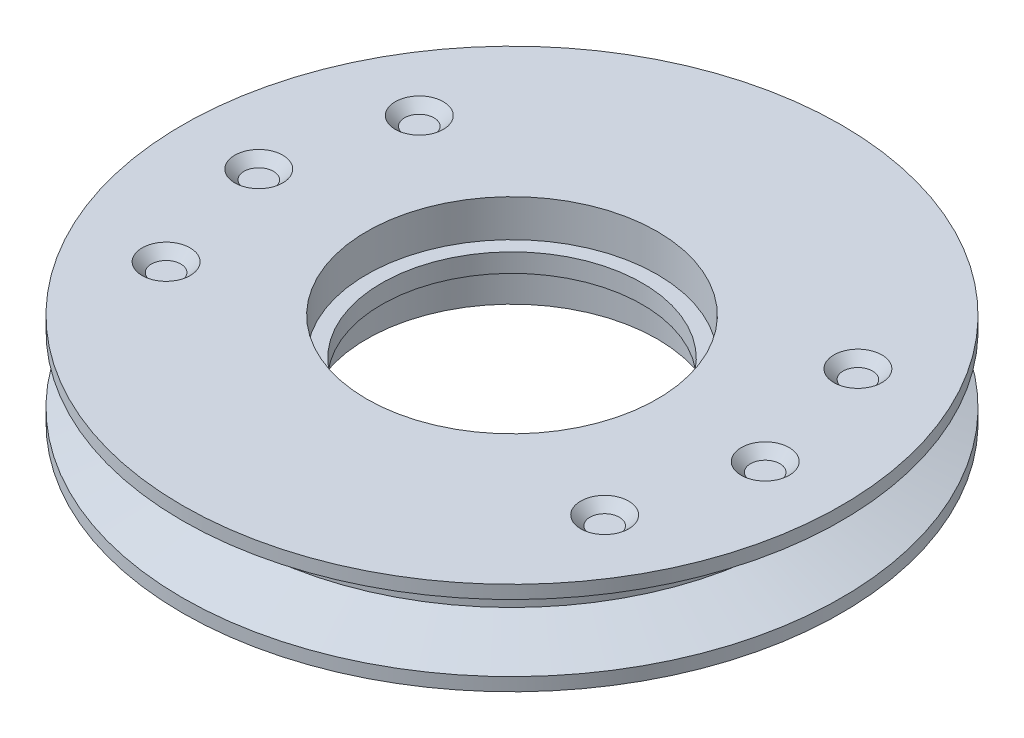
from build123d import *

# Parameters (mm, degrees)
CROQUIS9_R                      = 6.45
CORTAR_EXTRUIR1_DEPTH           = 2.5
CORTAR_EXTRUIR1_DRAFT           = -45
CORTAR_EXTRUIR1_PROFILE_2_DEPTH = 2.5
CORTAR_EXTRUIR1_PROFILE_2_DRAFT = -45
CORTAR_EXTRUIR1_PROFILE_3_DEPTH = 2.5
CORTAR_EXTRUIR1_PROFILE_3_DRAFT = -45
CORTAR_EXTRUIR1_PROFILE_4_DEPTH = 2.5
CORTAR_EXTRUIR1_PROFILE_4_DRAFT = -45
CORTAR_EXTRUIR1_PROFILE_5_DEPTH = 2.5
CORTAR_EXTRUIR1_PROFILE_5_DRAFT = -45
CORTAR_EXTRUIR1_PROFILE_6_DEPTH = 2.5
CORTAR_EXTRUIR1_PROFILE_6_DRAFT = -45
CROQUIS10_R                     = 39
CROQUIS10_R_2                   = 35
SALIENTE_EXTRUIR1_DEPTH         = 2.5


with BuildPart() as part:
    # Croquis5 → Revolución2 (revolve)
    with BuildSketch(Plane(origin=(0, 0, 0), x_dir=(0, 0, -1), z_dir=(1, 0, 0))):
        Polygon((39, 12.5), (39, -12.5), (88.5, -12.5), (88.5, -8.959553514), (73.5, -3.5), (73.5, 3.5), (88.5, 8.959553514), (88.5, 12.5), align=None)
    revolve(axis=Axis((0, 0, 0), (0, 1, 0)))


with BuildPart() as cortar_extruir1_tool:
    # Croquis9 → Cortar-Extruir1 (with draft: the straight prism first)
    with BuildSketch(Plane(origin=(0, 12.5, 0), x_dir=(1, 0, 0), z_dir=(0, 1, 0))):
        with Locations((58.889727457, 34)):
            Circle(CROQUIS9_R)
    extrude(amount=-CORTAR_EXTRUIR1_DEPTH)
    # Cortar-Extruir1: the draft: its side faces are tilted about the plane it starts from
    cortar_extruir1_sides = [cortar_extruir1_tool.faces().sort_by_distance(p)[0] for p in [
        (52.439727457, 11.25, -34),
    ]]
    draft(cortar_extruir1_sides, Plane(origin=(0, 12.5, 0), x_dir=(1, 0, 0), z_dir=(0, 1, 0)), CORTAR_EXTRUIR1_DRAFT)


with BuildPart() as part_1:
    add(part.part)

    # Cortar-Extruir1: cut by cortar_extruir1_tool
    add(cortar_extruir1_tool.part, mode=Mode.SUBTRACT)


with BuildPart() as cortar_extruir1_profile_2_tool:
    # Croquis9 → Cortar-Extruir1 profile 2 (with draft: the straight prism first)
    with BuildSketch(Plane(origin=(0, 12.5, 0), x_dir=(1, 0, 0), z_dir=(0, 1, 0))):
        with Locations((68, 0)):
            Circle(CROQUIS9_R)
    extrude(amount=-CORTAR_EXTRUIR1_PROFILE_2_DEPTH)
    # Cortar-Extruir1 profile 2: the draft: its side faces are tilted about the plane it starts from
    cortar_extruir1_profile_2_sides = [cortar_extruir1_profile_2_tool.faces().sort_by_distance(p)[0] for p in [
        (61.55, 11.25, 0),
    ]]
    draft(cortar_extruir1_profile_2_sides, Plane(origin=(0, 12.5, 0), x_dir=(1, 0, 0), z_dir=(0, 1, 0)), CORTAR_EXTRUIR1_PROFILE_2_DRAFT)


with BuildPart() as part_2:
    add(part_1.part)

    # Cortar-Extruir1 profile 2: cut by cortar_extruir1_profile_2_tool
    add(cortar_extruir1_profile_2_tool.part, mode=Mode.SUBTRACT)


with BuildPart() as cortar_extruir1_profile_3_tool:
    # Croquis9 → Cortar-Extruir1 profile 3 (with draft: the straight prism first)
    with BuildSketch(Plane(origin=(0, 12.5, 0), x_dir=(1, 0, 0), z_dir=(0, 1, 0))):
        with Locations((58.889727457, -34)):
            Circle(CROQUIS9_R)
    extrude(amount=-CORTAR_EXTRUIR1_PROFILE_3_DEPTH)
    # Cortar-Extruir1 profile 3: the draft: its side faces are tilted about the plane it starts from
    cortar_extruir1_profile_3_sides = [cortar_extruir1_profile_3_tool.faces().sort_by_distance(p)[0] for p in [
        (52.439727457, 11.25, 34),
    ]]
    draft(cortar_extruir1_profile_3_sides, Plane(origin=(0, 12.5, 0), x_dir=(1, 0, 0), z_dir=(0, 1, 0)), CORTAR_EXTRUIR1_PROFILE_3_DRAFT)


with BuildPart() as part_3:
    add(part_2.part)

    # Cortar-Extruir1 profile 3: cut by cortar_extruir1_profile_3_tool
    add(cortar_extruir1_profile_3_tool.part, mode=Mode.SUBTRACT)


with BuildPart() as cortar_extruir1_profile_4_tool:
    # Croquis9 → Cortar-Extruir1 profile 4 (with draft: the straight prism first)
    with BuildSketch(Plane(origin=(0, 12.5, 0), x_dir=(1, 0, 0), z_dir=(0, 1, 0))):
        with Locations((-58.889727457, -34)):
            Circle(CROQUIS9_R)
    extrude(amount=-CORTAR_EXTRUIR1_PROFILE_4_DEPTH)
    # Cortar-Extruir1 profile 4: the draft: its side faces are tilted about the plane it starts from
    cortar_extruir1_profile_4_sides = [cortar_extruir1_profile_4_tool.faces().sort_by_distance(p)[0] for p in [
        (-65.339727457, 11.25, 34),
    ]]
    draft(cortar_extruir1_profile_4_sides, Plane(origin=(0, 12.5, 0), x_dir=(1, 0, 0), z_dir=(0, 1, 0)), CORTAR_EXTRUIR1_PROFILE_4_DRAFT)


with BuildPart() as part_4:
    add(part_3.part)

    # Cortar-Extruir1 profile 4: cut by cortar_extruir1_profile_4_tool
    add(cortar_extruir1_profile_4_tool.part, mode=Mode.SUBTRACT)


with BuildPart() as cortar_extruir1_profile_5_tool:
    # Croquis9 → Cortar-Extruir1 profile 5 (with draft: the straight prism first)
    with BuildSketch(Plane(origin=(0, 12.5, 0), x_dir=(1, 0, 0), z_dir=(0, 1, 0))):
        with Locations((-68, 0)):
            Circle(CROQUIS9_R)
    extrude(amount=-CORTAR_EXTRUIR1_PROFILE_5_DEPTH)
    # Cortar-Extruir1 profile 5: the draft: its side faces are tilted about the plane it starts from
    cortar_extruir1_profile_5_sides = [cortar_extruir1_profile_5_tool.faces().sort_by_distance(p)[0] for p in [
        (-74.45, 11.25, 0),
    ]]
    draft(cortar_extruir1_profile_5_sides, Plane(origin=(0, 12.5, 0), x_dir=(1, 0, 0), z_dir=(0, 1, 0)), CORTAR_EXTRUIR1_PROFILE_5_DRAFT)


with BuildPart() as part_5:
    add(part_4.part)

    # Cortar-Extruir1 profile 5: cut by cortar_extruir1_profile_5_tool
    add(cortar_extruir1_profile_5_tool.part, mode=Mode.SUBTRACT)


with BuildPart() as cortar_extruir1_profile_6_tool:
    # Croquis9 → Cortar-Extruir1 profile 6 (with draft: the straight prism first)
    with BuildSketch(Plane(origin=(0, 12.5, 0), x_dir=(1, 0, 0), z_dir=(0, 1, 0))):
        with Locations((-58.889727457, 34)):
            Circle(CROQUIS9_R)
    extrude(amount=-CORTAR_EXTRUIR1_PROFILE_6_DEPTH)
    # Cortar-Extruir1 profile 6: the draft: its side faces are tilted about the plane it starts from
    cortar_extruir1_profile_6_sides = [cortar_extruir1_profile_6_tool.faces().sort_by_distance(p)[0] for p in [
        (-65.339727457, 11.25, -34),
    ]]
    draft(cortar_extruir1_profile_6_sides, Plane(origin=(0, 12.5, 0), x_dir=(1, 0, 0), z_dir=(0, 1, 0)), CORTAR_EXTRUIR1_PROFILE_6_DRAFT)


with BuildPart() as part_6:
    add(part_5.part)

    # Cortar-Extruir1 profile 6: cut by cortar_extruir1_profile_6_tool
    add(cortar_extruir1_profile_6_tool.part, mode=Mode.SUBTRACT)

    # Croquis10 → Saliente-Extruir1 (add, symmetric)
    with BuildSketch(Plane(origin=(0, 0, 0), x_dir=(1, 0, 0), z_dir=(0, 1, 0))):
        with Locations(Location((0, 0, 0), (0, 0, 90))):
            Circle(CROQUIS10_R)
        with Locations(Location((0, 0, 0), (0, 0, 270))):
            Circle(CROQUIS10_R_2, mode=Mode.SUBTRACT)
    extrude(amount=SALIENTE_EXTRUIR1_DEPTH, both=True)


solid = part_6.part
